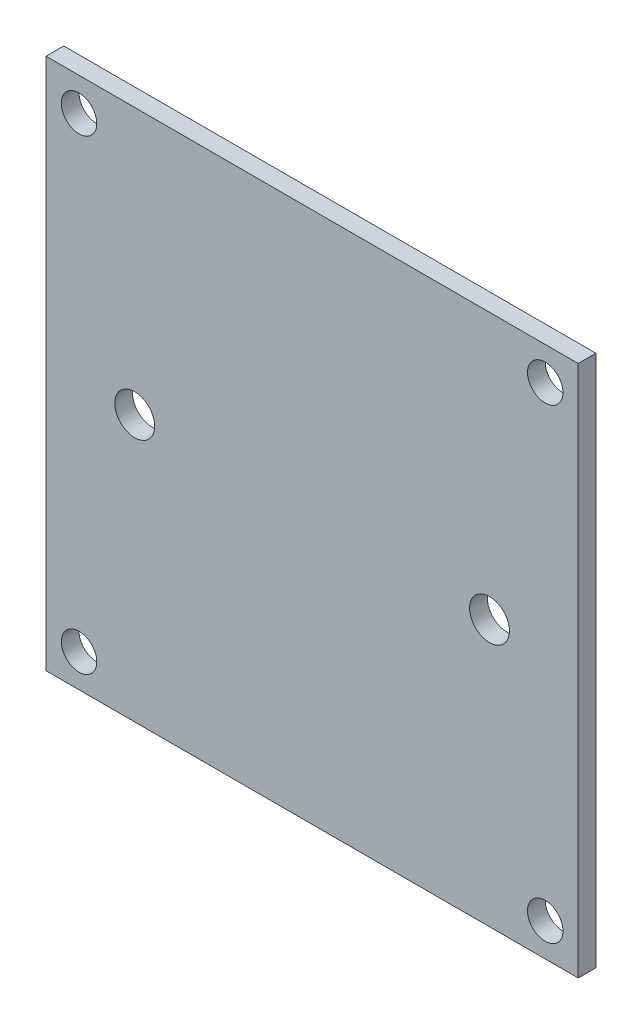
from build123d import *

# Parameters (mm, degrees)
SKETCH1_W           = 30
SKETCH1_H           = 30
BOSS_EXTRUDE1_DEPTH = 1
SKETCH2_R           = 1
SKETCH2_R_2         = 1.125
CUT_EXTRUDE1_DEPTH  = 22.236760582


with BuildPart() as part:
    # Sketch1 → Boss-Extrude1 (new body)
    with BuildSketch(Plane.XY):
        Rectangle(SKETCH1_W, SKETCH1_H)
    extrude(amount=BOSS_EXTRUDE1_DEPTH)

    # Sketch2 → Cut-Extrude1 (cut, through all)
    with BuildSketch(Plane.XY.offset(1)):
        with Locations((-13.14, 13.14)):
            Circle(SKETCH2_R)
        with Locations((13.14, 13.14)):
            Circle(SKETCH2_R)
        with Locations((13.14, -13.14)):
            Circle(SKETCH2_R)
        with Locations((-13.14, -13.14)):
            Circle(SKETCH2_R)
        with Locations((-10, 0)):
            Circle(SKETCH2_R_2)
        with Locations((10, 0)):
            Circle(SKETCH2_R_2)
    extrude(amount=-CUT_EXTRUDE1_DEPTH, mode=Mode.SUBTRACT)


solid = part.part
